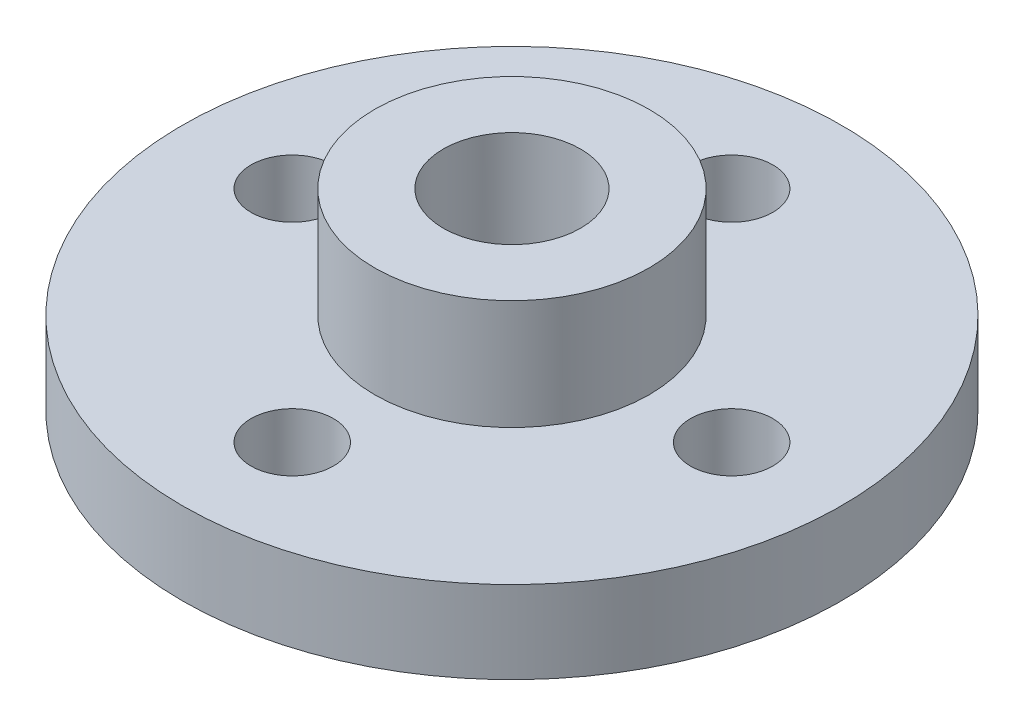
from build123d import *
from build123d.topology import SkipClean

# Parameters (mm, degrees)
ESQUISSE1_R             = 12
BOSS_EXTRU_1_DEPTH      = 3
ESQUISSE2_R             = 5
ESQUISSE2_R_2           = 2.5
BOSS_EXTRU_2_DEPTH      = 4
ENL_V_MAT_EXTRU_1_REACH = 20.358
ESQUISSE3_R             = 2.5
ENL_V_MAT_EXTRU_2_REACH = 20.358
ESQUISSE4_R             = 1.5


with BuildPart() as part:
    # Esquisse1 → Boss.-Extru.1 (new body)
    with BuildSketch(Plane(origin=(0, 0, 0), x_dir=(1, 0, 0), z_dir=(0, 1, 0))):
        with Locations(Location((0, 0, 0), (0, 0, 270))):
            Circle(ESQUISSE1_R)
    extrude(amount=BOSS_EXTRU_1_DEPTH)

    # Esquisse2 → Boss.-Extru.2 (add)
    with BuildSketch(Plane(origin=(0, 3, 0), x_dir=(1, 0, 0), z_dir=(0, 1, 0))):
        with Locations(Location((0, 0, 0), (0, 0, 270))):
            Circle(ESQUISSE2_R)
        with Locations(Location((0, 0, 0), (0, 0, 270))):
            Circle(ESQUISSE2_R_2, mode=Mode.SUBTRACT)
    extrude(amount=BOSS_EXTRU_2_DEPTH)

    # Esquisse3 → Enlèv. mat.-Extru.1 (cut, up to next)
    with BuildSketch(Plane.XZ, mode=Mode.PRIVATE) as enl_v_mat_extru_1_sk1:
        with Locations(Location((0, 0, 0), (0, 0, 270))):
            Circle(ESQUISSE3_R)
    enl_v_mat_extru_1_tool1 = extrude(enl_v_mat_extru_1_sk1.sketch, amount=-ENL_V_MAT_EXTRU_1_REACH, mode=Mode.PRIVATE) & part.part
    add(enl_v_mat_extru_1_tool1.solids().sort_by_distance((0, 0, 0))[0], mode=Mode.SUBTRACT)

    # Esquisse4 → Enlèv. mat.-Extru.2 (cut, up to next)
    with BuildSketch(Plane.XZ, mode=Mode.PRIVATE) as enl_v_mat_extru_2_sk1:
        with Locations(Location((0, 8, 0), (0, 0, 270))):
            Circle(ESQUISSE4_R)
    enl_v_mat_extru_2_tool1 = extrude(enl_v_mat_extru_2_sk1.sketch, amount=-ENL_V_MAT_EXTRU_2_REACH, mode=Mode.PRIVATE) & part.part
    # Esquisse4 → Enlèv. mat.-Extru.2 (cut, up to next)
    with BuildSketch(Plane.XZ, mode=Mode.PRIVATE) as enl_v_mat_extru_2_sk2:
        with Locations(Location((8, 0, 0), (0, 0, 270))):
            Circle(ESQUISSE4_R)
    enl_v_mat_extru_2_tool2 = extrude(enl_v_mat_extru_2_sk2.sketch, amount=-ENL_V_MAT_EXTRU_2_REACH, mode=Mode.PRIVATE) & part.part
    # Esquisse4 → Enlèv. mat.-Extru.2 (cut, up to next)
    with BuildSketch(Plane.XZ, mode=Mode.PRIVATE) as enl_v_mat_extru_2_sk3:
        with Locations(Location((0, -8, 0), (0, 0, 270))):
            Circle(ESQUISSE4_R)
    enl_v_mat_extru_2_tool3 = extrude(enl_v_mat_extru_2_sk3.sketch, amount=-ENL_V_MAT_EXTRU_2_REACH, mode=Mode.PRIVATE) & part.part
    # Esquisse4 → Enlèv. mat.-Extru.2 (cut, up to next)
    with BuildSketch(Plane.XZ, mode=Mode.PRIVATE) as enl_v_mat_extru_2_sk4:
        with Locations(Location((-8, 0, 0), (0, 0, 270))):
            Circle(ESQUISSE4_R)
    enl_v_mat_extru_2_tool4 = extrude(enl_v_mat_extru_2_sk4.sketch, amount=-ENL_V_MAT_EXTRU_2_REACH, mode=Mode.PRIVATE) & part.part
    add(enl_v_mat_extru_2_tool1.solids().sort_by_distance((0, 0, 8))[0], mode=Mode.SUBTRACT)
    add(enl_v_mat_extru_2_tool2.solids().sort_by_distance((8, 0, 0))[0], mode=Mode.SUBTRACT)
    add(enl_v_mat_extru_2_tool3.solids().sort_by_distance((0, 0, -8))[0], mode=Mode.SUBTRACT)
    add(enl_v_mat_extru_2_tool4.solids().sort_by_distance((-8, 0, 0))[0], mode=Mode.SUBTRACT)


solid = part.part
